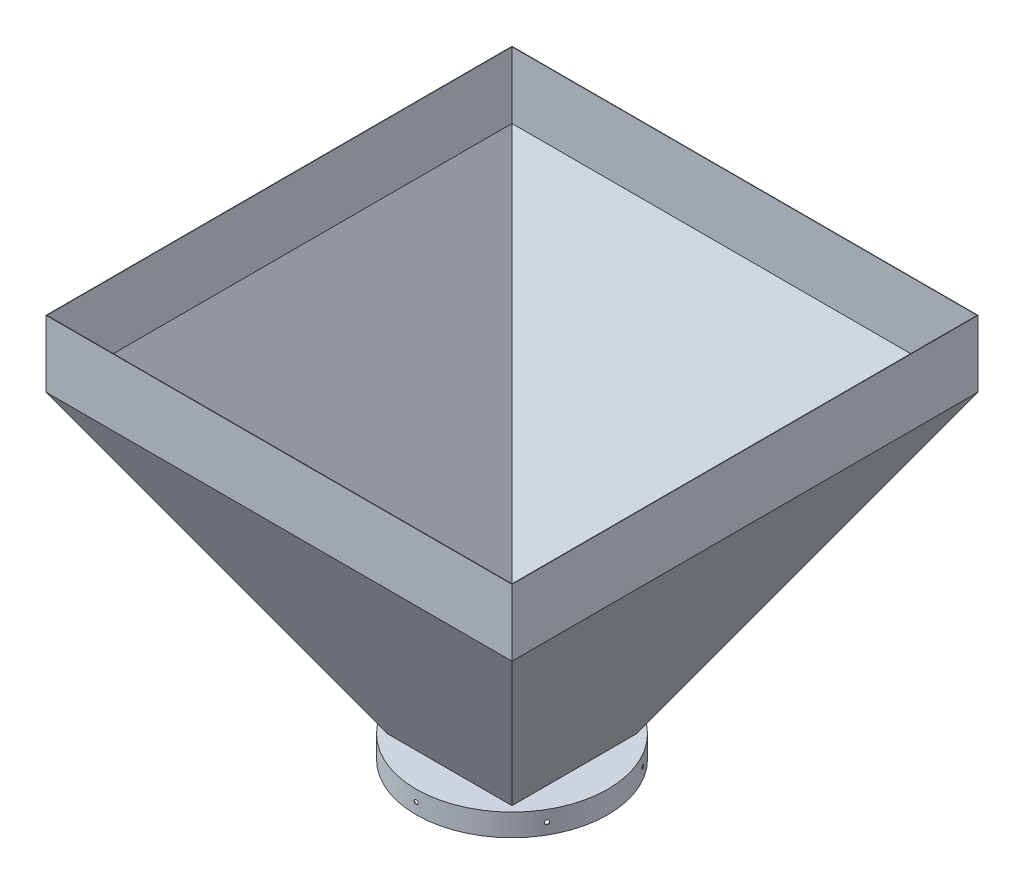
from build123d import *

# Parameters (mm, degrees)
CROQUIS3_W                   = 1050
CROQUIS3_H                   = 1050
SALIENTE_EXTRUIR1_DEPTH      = 150
CROQUIS4_R                   = 215.9
SALIENTE_EXTRUIR2_DEPTH      = 50
VACIADO1_T                   = -1
TALADRO_DE_MARGEN_PARA_M81_D = 9
MATRIZC1_COUNT               = 6


with BuildPart() as part:
    # Croquis1 → Recubrir1 section 0
    with BuildSketch(Plane(origin=(0, 0, 0), x_dir=(1, 0, 0), z_dir=(0, 1, 0))):
        with BuildLine():
            Line((-525, 525), (525, 525))
            Line((525, 525), (525, -525))
            Line((525, -525), (-525, -525))
            Line((-525, -525), (-525, 525))
        make_face()
    # Croquis2 → Recubrir1 section 1
    with BuildSketch(Plane(origin=(0, -666.844, 0), x_dir=(-1, 0, 0), z_dir=(0, -1, 0))):
        with BuildLine():
            Line((-140, -140), (140, -140))
            Line((140, -140), (140, 140))
            Line((140, 140), (-140, 140))
            Line((-140, 140), (-140, -140))
        make_face()
    loft()

    # Croquis3 → Saliente-Extruir1 (add)
    with BuildSketch(Plane(origin=(0, 0, 0), x_dir=(1, 0, 0), z_dir=(0, 1, 0))):
        Rectangle(CROQUIS3_W, CROQUIS3_H)
    extrude(amount=SALIENTE_EXTRUIR1_DEPTH)

    # Croquis4 → Saliente-Extruir2 (add)
    with BuildSketch(Plane.XZ.offset(666.844)):
        with Locations(Location((0, 0, 0), (0, 0, 270))):
            Circle(CROQUIS4_R)
    extrude(amount=SALIENTE_EXTRUIR2_DEPTH)

    # Vaciado1
    vaciado1_openings = [part.faces().sort_by_distance(p)[0] for p in [
        (0, 150, 0),
        (0, -716.844, 0),
    ]]
    offset(amount=VACIADO1_T, openings=vaciado1_openings, kind=Kind.INTERSECTION)

    # Taladro de margen para M81 (through all)
    with Locations(Plane(origin=(0, 0, -215.9), x_dir=(-1, 0, 0), z_dir=(0, 0, -1))):
        with Locations((0, -691.844)):
            taladro_de_margen_para_m81 = Hole(TALADRO_DE_MARGEN_PARA_M81_D / 2)

    # MatrizC1: Taladro de margen para M81 ×6 about axis
    matrizc1_axis = Axis((0, -716.844, 0), (0, 1, 0))
    for i in range(1, MATRIZC1_COUNT):
        add(taladro_de_margen_para_m81.rotate(matrizc1_axis, i * 360 / MATRIZC1_COUNT), mode=Mode.SUBTRACT)


solid = part.part
